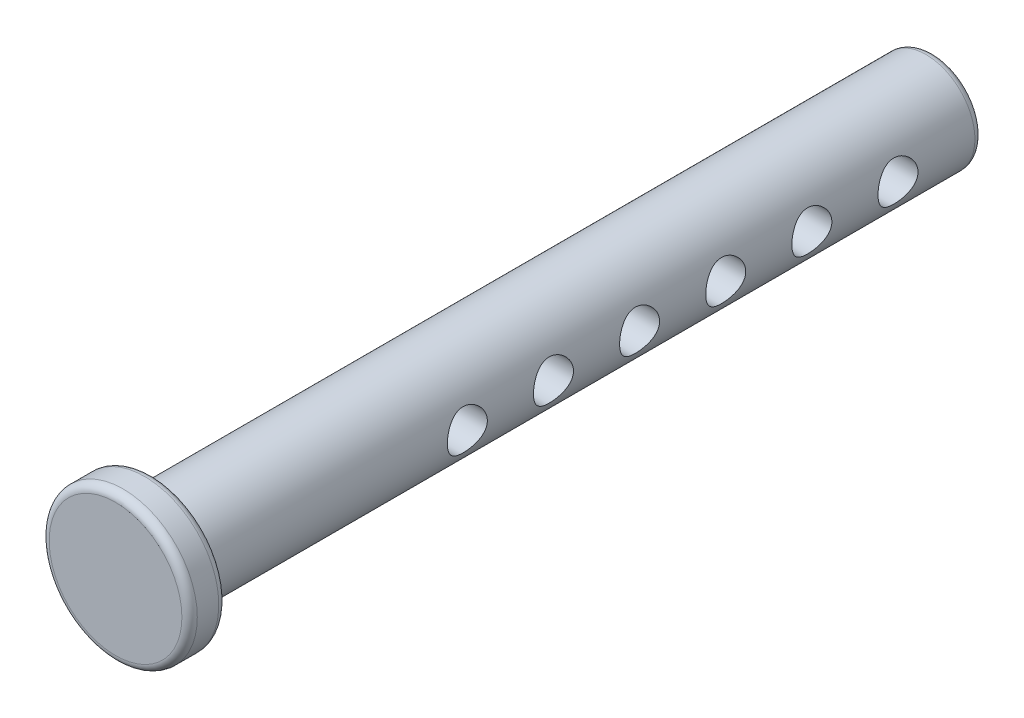
from build123d import *

# Parameters (mm, degrees)
CUT_EXTRUDE1_DEPTH      = 54.63402325
CUT_EXTRUDE1_DEPTH_BACK = 54.63402325
SKETCH2_R               = 1.3
F7F_R                   = 0.5
FILLET2_R               = 0.5


with BuildPart() as part:
    # Sketch1 → Revolve1 (revolve)
    with BuildSketch(Plane.YZ, mode=Mode.PRIVATE) as revolve1_sk:
        Polygon((0, 0), (4.815, 0), (4.815, -2.4), (3.175, -2.4), (3.175, -53.2), (0, -53.2), align=None)
    revolve(revolve1_sk.sketch.rotate(Axis((0, 0, -335.576810525), (0, 0, 1)), 90), axis=Axis((0, 0, -335.576810525), (0, 0, 1)))

    # Sketch2 → Cut-Extrude1 (cut, two sides: drawn at the far end of the back side and taken through both)
    with BuildSketch(Plane.YZ.offset(-CUT_EXTRUDE1_DEPTH_BACK)):
        with Locations(Location((0, -47.7, 0), (0, 0, 270.000000002))):
            Circle(SKETCH2_R)
        with Locations(Location((0, -42.1, 0), (0, 0, 270.000000002))):
            Circle(SKETCH2_R)
        with Locations(Location((0, -25.3, 0), (0, 0, 270.000000002))):
            Circle(SKETCH2_R)
        with Locations(Location((0, -30.9, 0), (0, 0, 270.000000002))):
            Circle(SKETCH2_R)
        with Locations(Location((0, -36.5, 0), (0, 0, 270.000000002))):
            Circle(SKETCH2_R)
        with Locations(Location((0, -19.7, 0), (0, 0, 270.000000002))):
            Circle(SKETCH2_R)
    extrude(amount=CUT_EXTRUDE1_DEPTH + CUT_EXTRUDE1_DEPTH_BACK, mode=Mode.SUBTRACT)

    # f7f
    f7f_edges = [part.edges().sort_by_distance(p)[0] for p in [
        (4.815, 0, -2.4),
        (4.815, 0, 0),
    ]]
    fillet(f7f_edges, radius=F7F_R)

    # Fillet2
    fillet2_edges = [part.edges().sort_by_distance(p)[0] for p in [
        (3.175, 0, -53.2),
    ]]
    fillet(fillet2_edges, radius=FILLET2_R)


solid = part.part
